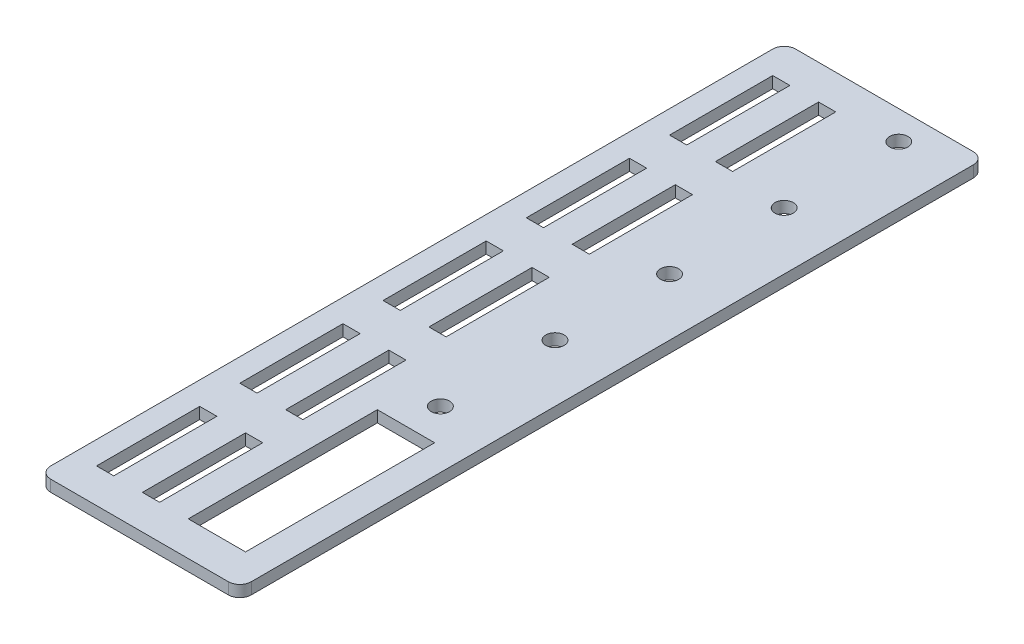
from build123d import *

# Parameters (mm, degrees)
SKETCH_1_W      = 35
SKETCH_1_H      = 130
SKETCH_1_R      = 1.6
SKETCH_1_W_2    = 3
SKETCH_1_H_2    = 18
SKETCH_1_W_3    = 10
SKETCH_1_H_3    = 33
EXTRUDE_1_DEPTH = 2
FILLET_1_R      = 2


with BuildPart() as part:
    # 草图1 → 凸台-拉伸1 (new body)
    with BuildSketch(Plane(origin=(0, 0, 0), x_dir=(1, 0, 0), z_dir=(0, 1, 0))):
        with Locations((-17.5, 0)):
            Rectangle(SKETCH_1_W, SKETCH_1_H)
        with Locations(Location((-10, 60, 0), (0, 0, 270))):
            Circle(SKETCH_1_R, mode=Mode.SUBTRACT)
        with Locations(Location((-10, 40, 0), (0, 0, 270))):
            Circle(SKETCH_1_R, mode=Mode.SUBTRACT)
        with Locations(Location((-10, 20, 0), (0, 0, 270))):
            Circle(SKETCH_1_R, mode=Mode.SUBTRACT)
        with Locations(Location((-10, 0, 0), (0, 0, 270))):
            Circle(SKETCH_1_R, mode=Mode.SUBTRACT)
        with Locations(Location((-10, -20, 0), (0, 0, 270))):
            Circle(SKETCH_1_R, mode=Mode.SUBTRACT)
        with Locations((-29.5, 50)):
            Rectangle(SKETCH_1_W_2, SKETCH_1_H_2, mode=Mode.SUBTRACT)
        with Locations((-21.5, 50)):
            Rectangle(SKETCH_1_W_2, SKETCH_1_H_2, mode=Mode.SUBTRACT)
        with Locations((-29.5, 25)):
            Rectangle(SKETCH_1_W_2, SKETCH_1_H_2, mode=Mode.SUBTRACT)
        with Locations((-29.5, 0)):
            Rectangle(SKETCH_1_W_2, SKETCH_1_H_2, mode=Mode.SUBTRACT)
        with Locations((-29.5, -25)):
            Rectangle(SKETCH_1_W_2, SKETCH_1_H_2, mode=Mode.SUBTRACT)
        with Locations((-29.5, -50)):
            Rectangle(SKETCH_1_W_2, SKETCH_1_H_2, mode=Mode.SUBTRACT)
        with Locations((-21.5, 25)):
            Rectangle(SKETCH_1_W_2, SKETCH_1_H_2, mode=Mode.SUBTRACT)
        with Locations((-21.5, 0)):
            Rectangle(SKETCH_1_W_2, SKETCH_1_H_2, mode=Mode.SUBTRACT)
        with Locations((-21.5, -25)):
            Rectangle(SKETCH_1_W_2, SKETCH_1_H_2, mode=Mode.SUBTRACT)
        with Locations((-21.5, -50)):
            Rectangle(SKETCH_1_W_2, SKETCH_1_H_2, mode=Mode.SUBTRACT)
        with Locations((-10, -42.5)):
            Rectangle(SKETCH_1_W_3, SKETCH_1_H_3, mode=Mode.SUBTRACT)
    extrude(amount=EXTRUDE_1_DEPTH)

    # 圆角1
    fillet_1_edges = [part.edges().sort_by_distance(p)[0] for p in [
        (0, 1, 65),
        (-35, 1, 65),
        (-35, 1, -65),
        (0, 1, -65),
    ]]
    fillet(fillet_1_edges, radius=FILLET_1_R)


solid = part.part
